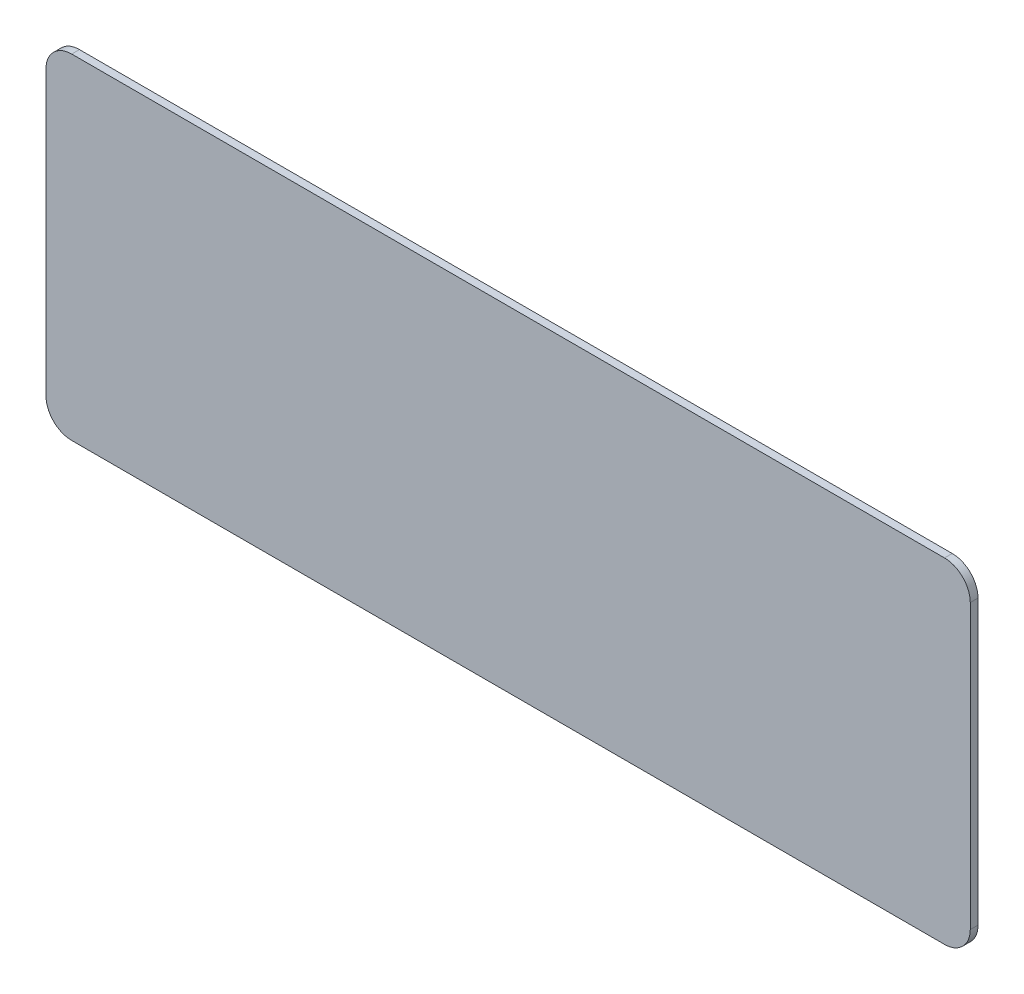
from build123d import *

# Parameters (mm, degrees)
SKETCH1_W           = 359
SKETCH1_H           = 130
BOSS_EXTRUDE1_DEPTH = 3
FILLET1_R           = 10


with BuildPart() as part:
    # Sketch1 → Boss-Extrude1 (new body)
    with BuildSketch(Plane.XY):
        Rectangle(SKETCH1_W, SKETCH1_H)
    extrude(amount=BOSS_EXTRUDE1_DEPTH)

    # Fillet1
    fillet1_edges = [part.edges().sort_by_distance(p)[0] for p in [
        (179.5, -65, 1.5),
        (-179.5, -65, 1.5),
        (-179.5, 65, 1.5),
        (179.5, 65, 1.5),
    ]]
    fillet(fillet1_edges, radius=FILLET1_R)


solid = part.part
